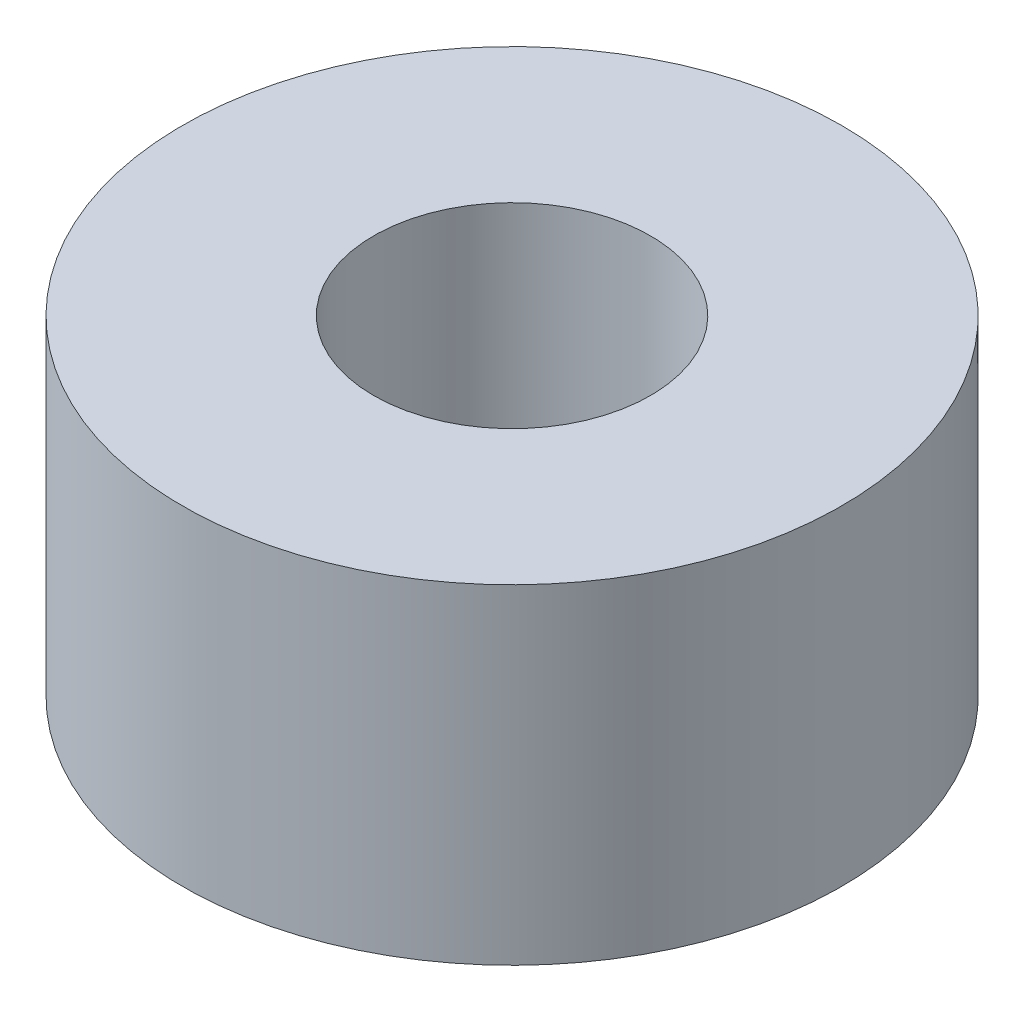
from build123d import *

# Parameters (mm, degrees)
SKETCH_1_W          = 15
SKETCH_1_H          = 15
SKETCH_2_R          = 6.3
SHAFT_PASSAGE_DEPTH = 26.980762114


with BuildPart() as part:
    # 草图1 → Drive_mount_spacer (revolve)
    with BuildSketch(Plane.XY, mode=Mode.PRIVATE) as drive_mount_spacer_sk:
        with Locations((7.5, 7.5)):
            Rectangle(SKETCH_1_W, SKETCH_1_H)
    revolve(drive_mount_spacer_sk.sketch.rotate(Axis((0, 0, 0), (0, 1, 0)), 90), axis=Axis((0, 0, 0), (0, 1, 0)))

    # 草图2 → Shaft_passage (cut, through all)
    with BuildSketch(Plane(origin=(0, 15, 0), x_dir=(1, 0, 0), z_dir=(0, 1, 0))):
        with Locations(Location((0, 0, 0), (0, 0, 270))):
            Circle(SKETCH_2_R)
    extrude(amount=-SHAFT_PASSAGE_DEPTH, mode=Mode.SUBTRACT)


solid = part.part
